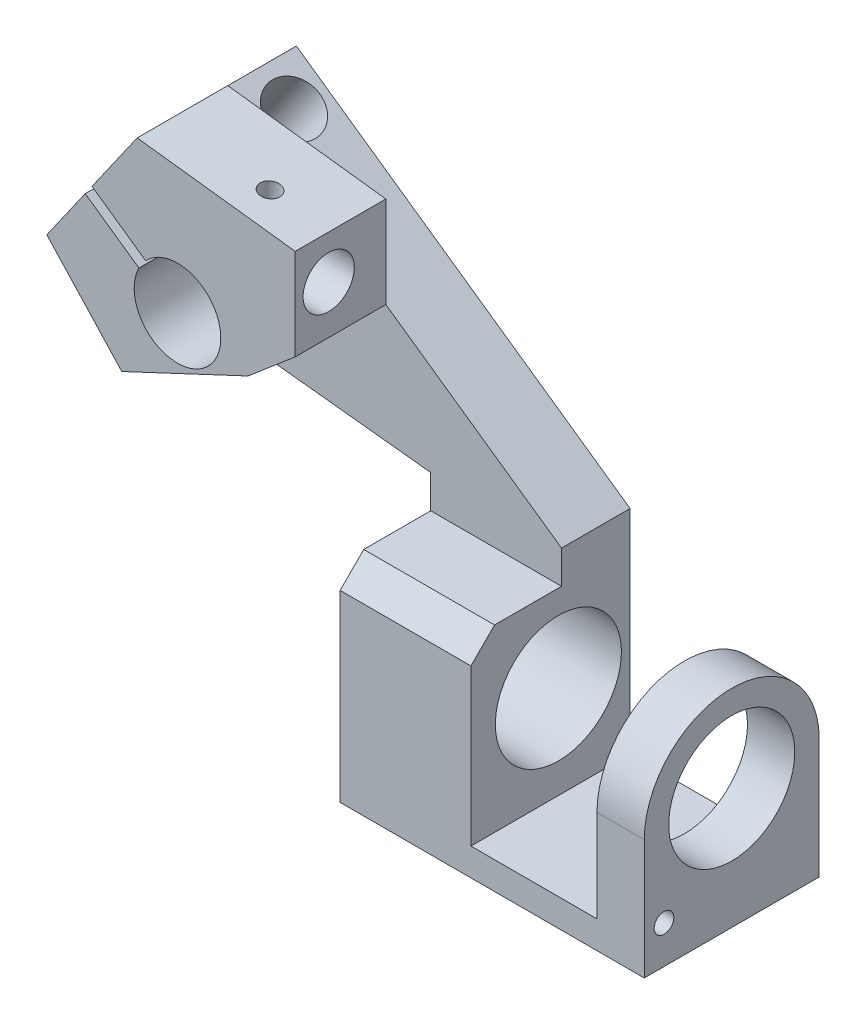
from build123d import *

# Parameters (mm, degrees)
EXTRUSION1_DEPTH      = 20.2
EXTRUSION2_DEPTH      = 8.7
EXTRUSION3_DEPTH      = 11.5
EXTRUSION5_DEPTH      = 85.851864404
ESQUISSE7_R           = 5.5
EXTRUSION7_DEPTH      = 85.851864404
CHANFREIN1_SIZE       = 3
ESQUISSE11_W          = 6
ESQUISSE11_H          = 3.5
EXTRUSION10_DEPTH     = 2
ESQUISSE12_W          = 6
ESQUISSE12_H          = 22.2
EXTRUSION11_DEPTH     = 11.7
EXTRUSION12_START     = -6
EXTRUSION12_DEPTH     = 6
D_GAGEMENT_M61_D      = 6.6
D_GAGEMENT_M61_DEPTH  = 10
TROU_TARAUD_M62_D     = 5
ESQUISSE21_R          = 8
EXTRUSION13_DEPTH     = 97.102649527
ESQUISSE22_R          = 3.25
EXTRUSION14_DEPTH     = 74.818126201
TROU_TARAUD_M31_D     = 2.5
TROU_TARAUD_M31_DEPTH = 4.5
TROU_TARAUD_M31_TIP   = 0.751075774
TROU_TARAUD_M32_D     = 2.5
TROU_TARAUD_M32_DEPTH = 7.5
TROU_TARAUD_M32_TIP   = 0.751075774


with BuildPart() as part:
    # Esquisse1 → Extrusion1 (new body)
    with BuildSketch(Plane.XY):
        Polygon((-23.713097305, 25.832589029), (-23.713097305, -4.667410971), (14.886902695, -4.667410971), (14.886902695, -1.167410971), (-7.113097305, -1.167410971), (-7.113097305, 21.632589029), (-7.113097305, 25.832589029), (-29.411236045, 41.445913863), (-29.411236045, 53.045913863), (-49.463257995, 55.486490788), (-60.934786722, 39.103449903), (-51.4215104, 28.832248725), (-42.076114027, 27.820534025), align=None)
    extrude(amount=EXTRUSION1_DEPTH)

    # Esquisse2 → Extrusion2 (cut)
    with BuildSketch(Plane(origin=(0, 0, 0), x_dir=(-1, 0, 0), z_dir=(0, 0, -1))):
        Polygon((49.463257995, 55.486490788), (29.411236045, 41.445913863), (29.411236045, 53.045913863), align=None)
    extrude(amount=-EXTRUSION2_DEPTH, mode=Mode.SUBTRACT)

    # Esquisse3 → Extrusion3 (cut)
    with BuildSketch(Plane.XY.offset(20.2)):
        Polygon((-29.411236045, 41.445913863), (-35.397890495, 36.351131961), (-51.4215104, 28.832248725), (-23.713097305, 25.832589029), (-23.713097305, 21.632589029), (-7.113097305, 21.632589029), (-7.113097305, 25.832589029), align=None)
    extrude(amount=-EXTRUSION3_DEPTH, mode=Mode.SUBTRACT)

    # Esquisse5 → Extrusion5 (cut, through all)
    with BuildSketch(Plane.XY.offset(20.2)):
        Polygon((-56.059387013, 46.066242279), (-55.199022358, 47.294970345), (-48.383798942, 42.522899535), (-49.244163597, 41.294171468), align=None)
    extrude(amount=-EXTRUSION5_DEPTH, mode=Mode.SUBTRACT)

    # Esquisse7 → Extrusion7 (cut, through all)
    with BuildSketch(Plane(origin=(0, 0, 0), x_dir=(-1, 0, 0), z_dir=(0, 0, -1))):
        with Locations((44.350730044, 38.783333349)):
            Circle(ESQUISSE7_R)
    extrude(amount=-EXTRUSION7_DEPTH, mode=Mode.SUBTRACT)

    # Chanfrein1
    chanfrein1_edges = [part.edges().sort_by_distance(p)[0] for p in [
        (-15.413097305, 21.632589029, 20.2),
    ]]
    chamfer(chanfrein1_edges, length=CHANFREIN1_SIZE)

    # Esquisse11 → Extrusion10 (add)
    with BuildSketch(Plane(origin=(0, 0, 0), x_dir=(-1, 0, 0), z_dir=(0, 0, -1))):
        with Locations((-11.886902695, -2.917410971)):
            Rectangle(ESQUISSE11_W, ESQUISSE11_H)
    extrude(amount=EXTRUSION10_DEPTH)

    # Esquisse12 → Extrusion11 (add)
    with BuildSketch(Plane(origin=(0, -1.167410971, 0), x_dir=(-1, 0, 0), z_dir=(0, 1, 0))):
        with Locations((-11.886902695, 9.1)):
            Rectangle(ESQUISSE12_W, ESQUISSE12_H)
    extrude(amount=EXTRUSION11_DEPTH)

    # Esquisse13 → Extrusion12 (add)
    with BuildSketch(Plane(origin=(14.886902695, 0, 0), x_dir=(0, 0, -1), z_dir=(1, 0, 0)).offset(EXTRUSION12_START)):
        with BuildLine():
            Line((-20.2, 10.532589029), (2, 10.532589029))
            ThreePointArc((2, 10.532589029), (-9.1, 21.632589029), (-20.2, 10.532589029))
        make_face()
    extrude(amount=EXTRUSION12_DEPTH)

    # Dégagement M61
    with Locations(Plane(origin=(-45.470336254, 52.690616886, 4.293910537), x_dir=(0.819152044289, -0.573576436351, 0), z_dir=(0.573576436351, 0.819152044289, 0))):
        with Locations((1e-09, 0)):
            Hole(D_GAGEMENT_M61_D / 2, depth=D_GAGEMENT_M61_DEPTH)

    # Trou taraudé M62 (through all)
    with Locations(Plane(origin=(-52.066839949, 43.270630728, 4.294), x_dir=(0.819152044289, -0.573576436351, 0), z_dir=(0.573576436351, 0.819152044289, 0))):
        with Locations((0, 0)):
            Hole(TROU_TARAUD_M62_D / 2)

    # Esquisse21 → Extrusion13 (cut, through all)
    with BuildSketch(Plane(origin=(14.886902695, 0, 0), x_dir=(0, 0, -1), z_dir=(1, 0, 0))):
        with Locations((-9.1, 10.632589029)):
            Circle(ESQUISSE21_R)
    extrude(amount=-EXTRUSION13_DEPTH, mode=Mode.SUBTRACT)

    # Esquisse22 → Extrusion14 (cut, through all)
    with BuildSketch(Plane(origin=(-29.411236045, 0, 0), x_dir=(0, 0, -1), z_dir=(1, 0, 0))):
        with Locations(Location((-15.95, 47.545913863, 0), (0, 0, 90))):
            Circle(ESQUISSE22_R)
    extrude(amount=-EXTRUSION14_DEPTH, mode=Mode.SUBTRACT)

    # Trou taraudé M31
    with Locations(Plane(origin=(5.932756634, 48.744116607, 0), x_dir=(-0.992674353944791, 0.1208206398770179, 0), z_dir=(0.12082063987701788, 0.9926743539447909, 0))):
        with Locations((43.104820996, 15.95)):
            Hole(TROU_TARAUD_M31_D / 2, depth=TROU_TARAUD_M31_DEPTH)
            with Locations((0, 0, -(TROU_TARAUD_M31_DEPTH + TROU_TARAUD_M31_TIP / 2))):  # 118° drill point
                Cone(0, TROU_TARAUD_M31_D / 2, TROU_TARAUD_M31_TIP, mode=Mode.SUBTRACT)

    # Trou taraudé M32
    with Locations(Plane(origin=(14.886902695, 0.132589029, 17.7), x_dir=(0, 0, 1), z_dir=(1, 0, 0))):
        with Locations((0, 0)):
            Hole(TROU_TARAUD_M32_D / 2, depth=TROU_TARAUD_M32_DEPTH)
            with Locations((0, 0, -(TROU_TARAUD_M32_DEPTH + TROU_TARAUD_M32_TIP / 2))):  # 118° drill point
                Cone(0, TROU_TARAUD_M32_D / 2, TROU_TARAUD_M32_TIP, mode=Mode.SUBTRACT)


solid = part.part
